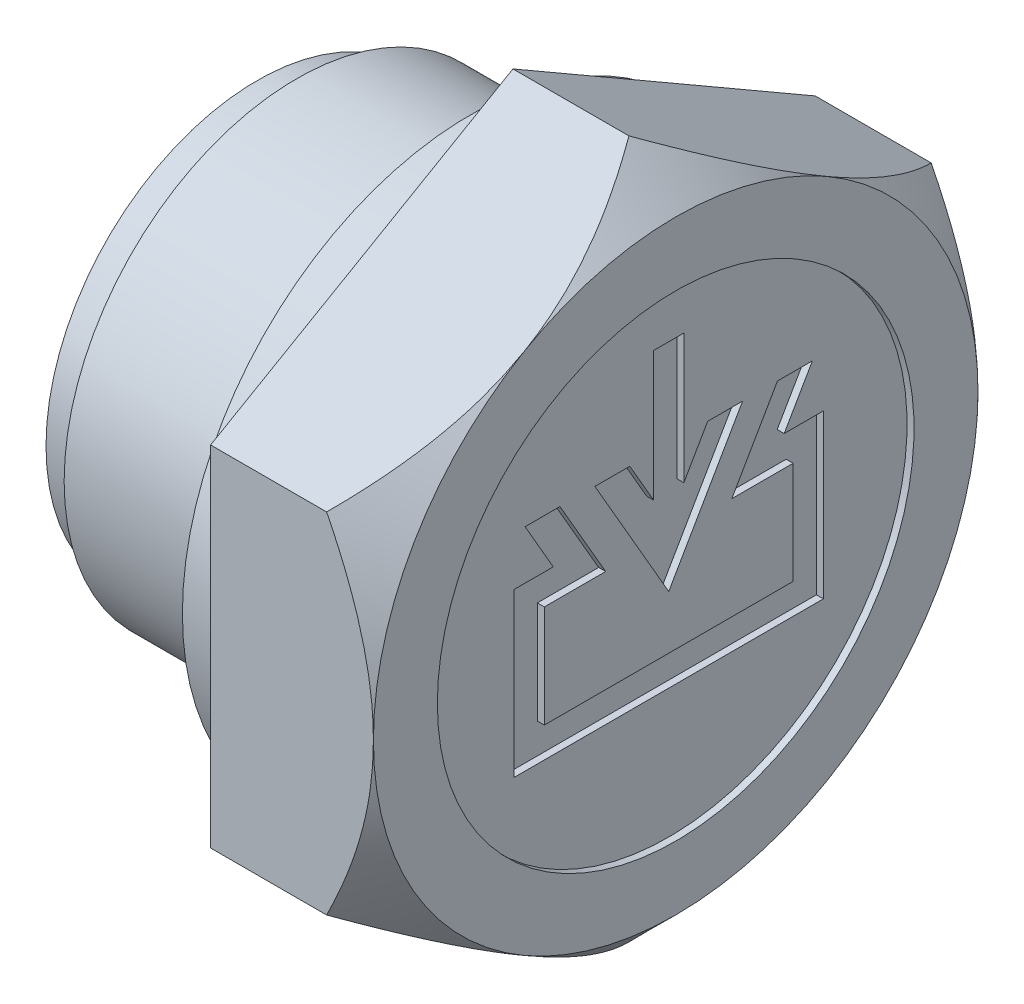
from build123d import *

# Parameters (mm, degrees)
TAGLIO_ESTRUSIONE1_DEPTH      = 0.3
TAGLIO_ESTRUSIONE1_DEPTH_BACK = 0.3
TAGLIO_ESTRUSIONE2_DEPTH      = 0.3
TAGLIO_ESTRUSIONE2_DEPTH_BACK = 0.3
TAGLIO_ESTRUSIONE3_DEPTH      = 10.701
TAGLIO_ESTRUSIONE3_DEPTH_BACK = 10.701


with BuildPart() as part:
    # Schizzo1 → Rivoluzione1 (revolve)
    with BuildSketch(Plane.XY):
        with BuildLine():
            Line((14.2, 0), (14.2, 5.687947352))
            ThreePointArc((14.2, 5.687947352), (14.0596699, 6.035276538), (13.717449748, 6.187642766))
            Line((13.717449748, 6.187642766), (0, 6.666666667))
            Line((0, 6.666666667), (0, 9.0798475))
            Line((0, 9.0798475), (1.7, 9.0798475))
            Line((1.7, 9.0798475), (1.7, 10))
            Line((1.7, 10), (9.166666667, 10))
            Line((9.166666667, 10), (9.166666667, 12.380952381))
            Line((9.166666667, 12.380952381), (11, 12.380952381))
            Line((11, 12.380952381), (11, 20))
            Line((11, 20), (18, 13))
            Line((18, 13), (18, 10.25))
            Line((18, 10.25), (17.7, 10.25))
            Line((17.7, 10.25), (17.7, 0))
            Line((17.7, 0), (14.2, 0))
        make_face()
    revolve(axis=Axis((18, 0, 0), (-1, 0, 0)))

    # Schizzo2 → Taglio-Estrusione1 (cut, two sides: drawn at the far end of the back side and taken through both)
    with BuildSketch(Plane(origin=(17.7, 0, 0), x_dir=(0, 0, -1), z_dir=(1, 0, 0)).offset(-TAGLIO_ESTRUSIONE1_DEPTH_BACK)):
        Polygon((-6.65, -4.7), (6.65, -4.7), (6.65, 2.3), (4.96521, 2.3), (6.17765, 4.4), (4.67654, 4.4), (2.71355, 1), (5.35, 1), (5.35, -3.4), (-5.35, -3.4), (-5.35, 1), (-2.71355, 1), (-4.67654, 4.4), (-6.17765, 4.4), (-4.96521, 2.3), (-6.65, 2.3), align=None)
    extrude(amount=TAGLIO_ESTRUSIONE1_DEPTH + TAGLIO_ESTRUSIONE1_DEPTH_BACK, mode=Mode.SUBTRACT)

    # Schizzo3 → Taglio-Estrusione2 (cut, two sides: drawn at the far end of the back side and taken through both)
    with BuildSketch(Plane(origin=(17.7, 0, 0), x_dir=(0, 0, -1), z_dir=(1, 0, 0)).offset(-TAGLIO_ESTRUSIONE2_DEPTH_BACK)):
        Polygon((-3.17543, 4.4), (0, -1.1), (3.17543, 4.4), (1.67432, 4.4), (0.65, 2.62583), (0.65, 8.2), (-0.65, 8.2), (-0.65, 2.62583), (-1.67432, 4.4), align=None)
    extrude(amount=TAGLIO_ESTRUSIONE2_DEPTH + TAGLIO_ESTRUSIONE2_DEPTH_BACK, mode=Mode.SUBTRACT)

    # Schizzo4 → Taglio-Estrusione3 (cut, two sides: drawn at the far end of the back side and taken through both)
    with BuildSketch(Plane(origin=(17.7, 0, 0), x_dir=(0, 0, -1), z_dir=(1, 0, 0)).offset(-TAGLIO_ESTRUSIONE3_DEPTH_BACK)):
        Polygon((-26, -15.011106999), (0, -30.022213998), (26, -15.011106999), (26, 15.011106999), (0, 30.022213998), (-26, 15.011106999), align=None)
        Polygon((-13, -7.505553499), (0, -15.011106999), (13, -7.505553499), (13, 7.505553499), (0, 15.011106999), (-13, 7.505553499), align=None, mode=Mode.SUBTRACT)
    extrude(amount=TAGLIO_ESTRUSIONE3_DEPTH + TAGLIO_ESTRUSIONE3_DEPTH_BACK, mode=Mode.SUBTRACT)


solid = part.part
